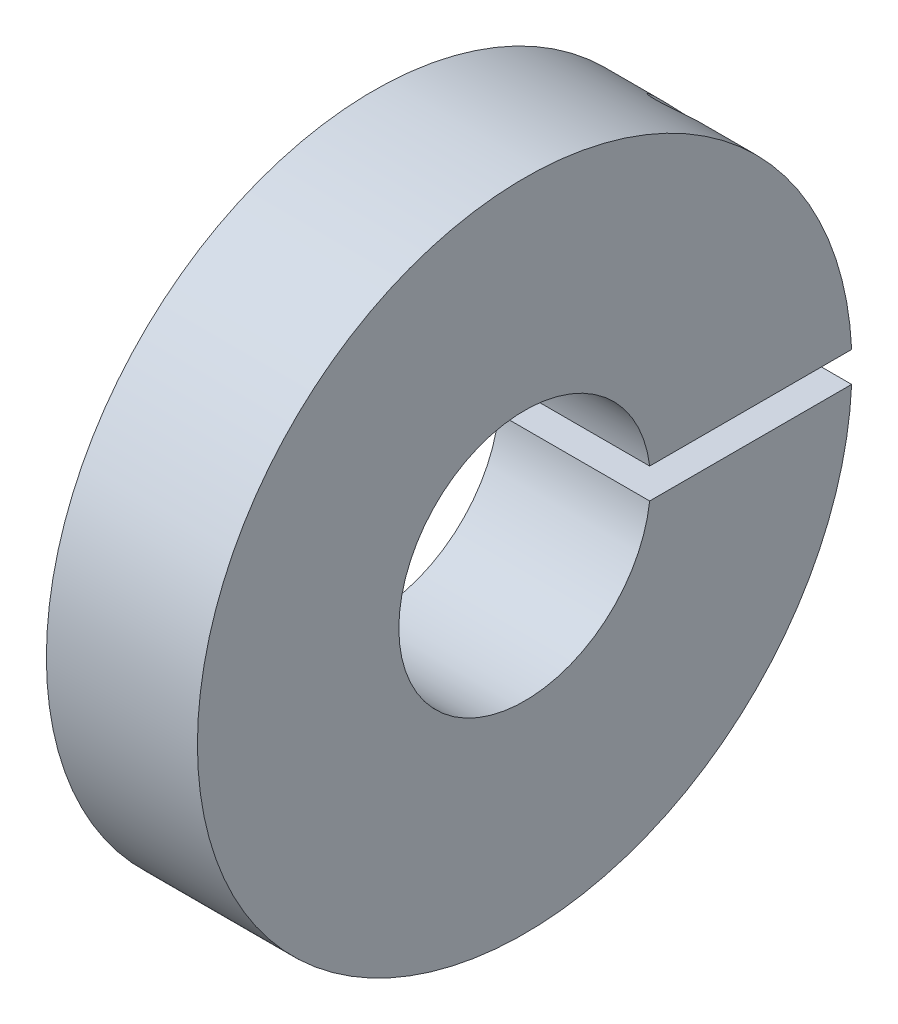
from build123d import *

# Parameters (mm, degrees)
SKETCH1_R               = 8.255
SKETCH1_R_2             = 3.175
BOSS_EXTRUDE1_DEPTH     = 1.905
SKETCH3_W               = 3.81
SKETCH3_H               = 8.255
CUT_EXTRUDE1_DEPTH      = 0.381
CUT_EXTRUDE2_DEPTH      = 12.828739366
CUT_EXTRUDE2_DEPTH_BACK = 12.828739366
SKETCH4_R               = 0.508


with BuildPart() as part:
    # Sketch1 → Boss-Extrude1 (new, symmetric)
    with BuildSketch(Plane(origin=(0, 0, 0), x_dir=(0, 0, -1), z_dir=(1, 0, 0))):
        with Locations(Location((0, 0, 0), (0, 0, 180))):
            Circle(SKETCH1_R)
        with Locations(Location((0, 0, 0), (0, 0, 180))):
            Circle(SKETCH1_R_2, mode=Mode.SUBTRACT)
    extrude(amount=BOSS_EXTRUDE1_DEPTH, both=True)

    # Sketch3 → Cut-Extrude1 (cut, symmetric)
    with BuildSketch(Plane(origin=(0, 0, 0), x_dir=(1, 0, 0), z_dir=(0, 1, 0))):
        with Locations((0, 4.1275)):
            Rectangle(SKETCH3_W, SKETCH3_H)
    extrude(amount=CUT_EXTRUDE1_DEPTH, both=True, mode=Mode.SUBTRACT)

    # Sketch4 → Cut-Extrude2 (cut, two sides: drawn at the far end of the back side and taken through both)
    with BuildSketch(Plane(origin=(0, 0, 0), x_dir=(1, 0, 0), z_dir=(0, 1, 0)).offset(-CUT_EXTRUDE2_DEPTH_BACK)):
        with Locations(Location((0, 5.706203005, 0), (0, 0, 270))):
            Circle(SKETCH4_R)
    extrude(amount=CUT_EXTRUDE2_DEPTH + CUT_EXTRUDE2_DEPTH_BACK, mode=Mode.SUBTRACT)


solid = part.part
